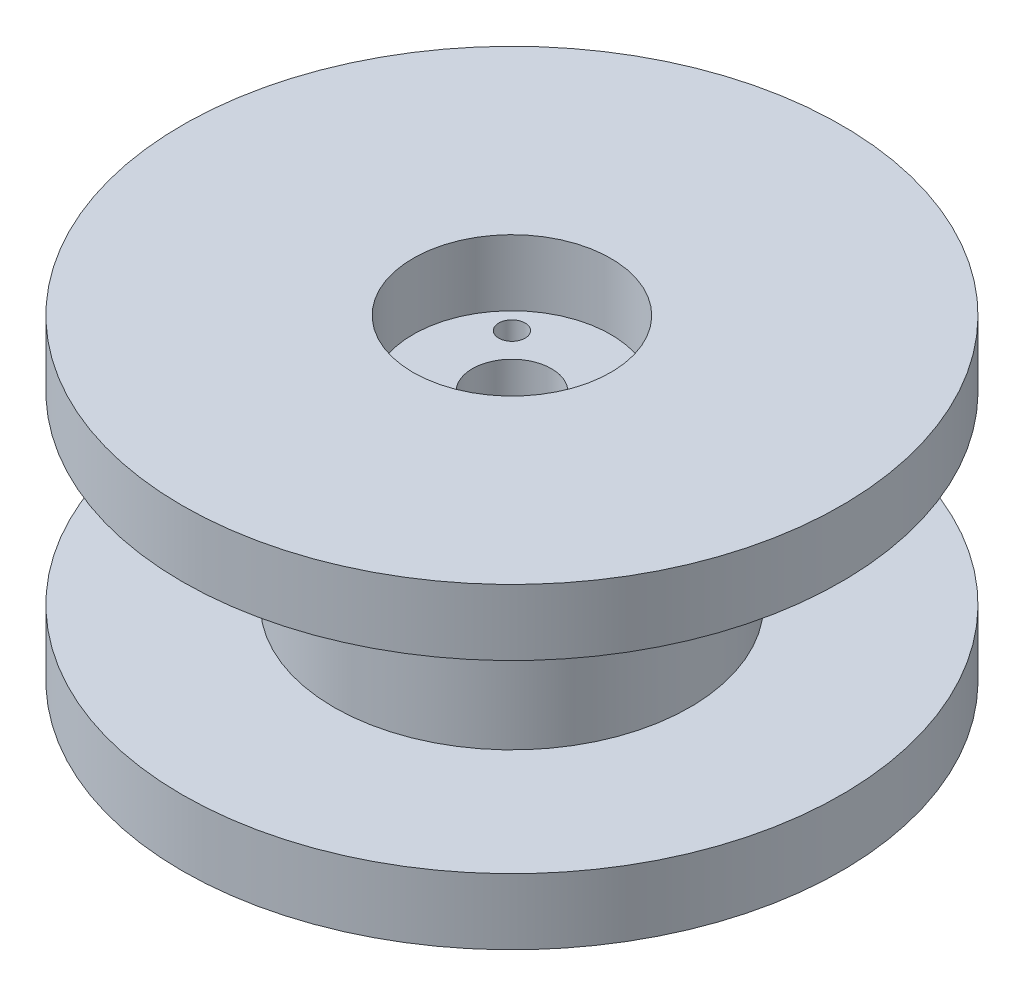
from build123d import *

# Parameters (mm, degrees)
CUT_EXTRUDE1_DEPTH      = 41.137264481
CUT_EXTRUDE1_DEPTH_BACK = 41.137264481
SKETCH2_R               = 3
SKETCH2_R_2             = 1


with BuildPart() as part:
    # Sketch1 → Revolve1 (revolve)
    with BuildSketch(Plane(origin=(0, 0, 0), x_dir=(0, 0, -1), z_dir=(1, 0, 0))):
        Polygon((0, 7), (0, -7), (-7.5, -7), (-7.5, -12), (-25, -12), (-25, -7), (-13.5, -7), (-13.5, 7), (-25, 7), (-25, 12), (-7.5, 12), (-7.5, 7), align=None)
    revolve(axis=Axis((0, 7, 0), (0, -1, 0)))

    # Sketch2 → Cut-Extrude1 (cut, two sides: drawn at the far end of the back side and taken through both)
    with BuildSketch(Plane.XZ.offset(7).offset(-CUT_EXTRUDE1_DEPTH_BACK)):
        with Locations(Location((0, 0, 0), (0, 0, 270))):
            Circle(SKETCH2_R)
        with Locations(Location((4, -4, 0), (0, 0, 270))):
            Circle(SKETCH2_R_2)
        with Locations(Location((-4, -4, 0), (0, 0, 270))):
            Circle(SKETCH2_R_2)
        with Locations(Location((-4, 4, 0), (0, 0, 270))):
            Circle(SKETCH2_R_2)
        with Locations(Location((4, 4, 0), (0, 0, 270))):
            Circle(SKETCH2_R_2)
    extrude(amount=CUT_EXTRUDE1_DEPTH + CUT_EXTRUDE1_DEPTH_BACK, mode=Mode.SUBTRACT)


solid = part.part
